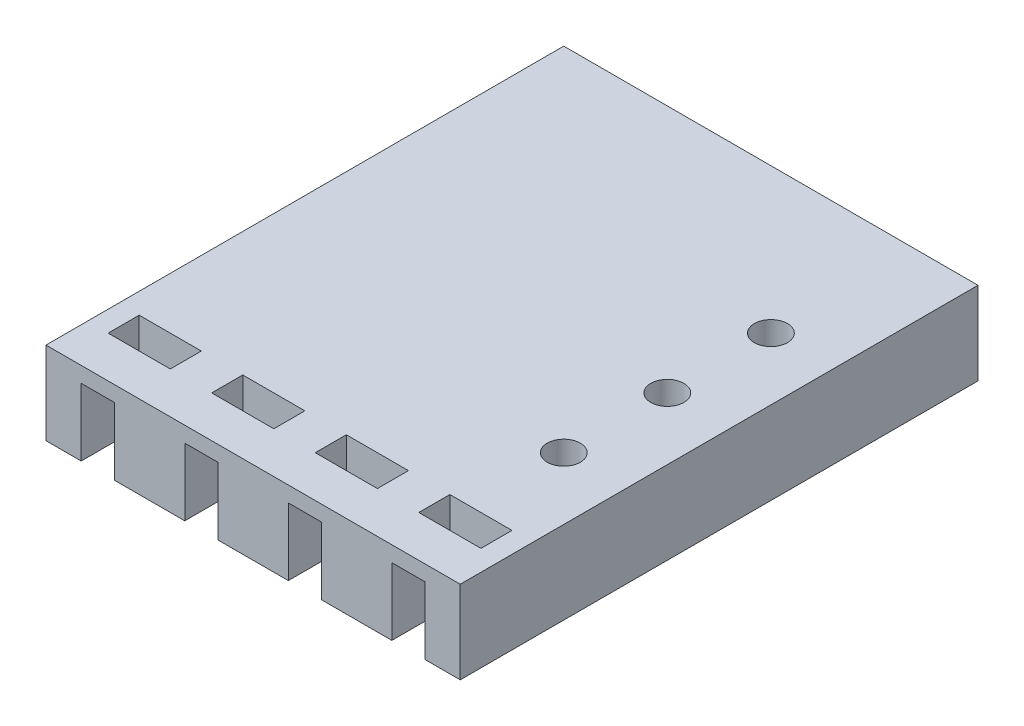
from build123d import *

# Parameters (mm, degrees)
SKETCH_1_W          = 40
SKETCH_1_H          = 50
EXTRUDE_1_DEPTH     = 8
SKETCH_2_W          = 3.2
SKETCH_2_H          = 4
CUT_EXTRUDE_1_DEPTH = 6.5
SKETCH_3_W          = 6
SKETCH_3_H          = 3
CUT_EXTRUDE_2_DEPTH = 16.5
SKETCH_10_R         = 1.6
CUT_EXTRUDE_7_DEPTH = 13
SKETCH_11_W         = 6
SKETCH_11_H         = 6
CUT_EXTRUDE_8_DEPTH = 3


with BuildPart() as part:
    # 草图1 → 凸台-拉伸1 (new body)
    with BuildSketch(Plane(origin=(0, 0, 0), x_dir=(1, 0, 0), z_dir=(0, 1, 0))):
        with Locations((20, 25)):
            Rectangle(SKETCH_1_W, SKETCH_1_H)
    extrude(amount=EXTRUDE_1_DEPTH)

    # 草图2 → 切除-拉伸1 (cut)
    with BuildSketch(Plane.XZ):
        with Locations((5, -2)):
            Rectangle(SKETCH_2_W, SKETCH_2_H)
        with Locations((15, -2)):
            Rectangle(SKETCH_2_W, SKETCH_2_H)
        with Locations((25, -2)):
            Rectangle(SKETCH_2_W, SKETCH_2_H)
        with Locations((35, -2)):
            Rectangle(SKETCH_2_W, SKETCH_2_H)
    extrude(amount=-CUT_EXTRUDE_1_DEPTH, mode=Mode.SUBTRACT)

    # 草图3 → 切除-拉伸2 (cut)
    with BuildSketch(Plane.XZ):
        with Locations((5, -5.5)):
            Rectangle(SKETCH_3_W, SKETCH_3_H)
        with Locations((15, -5.5)):
            Rectangle(SKETCH_3_W, SKETCH_3_H)
        with Locations((25, -5.5)):
            Rectangle(SKETCH_3_W, SKETCH_3_H)
        with Locations((35, -5.5)):
            Rectangle(SKETCH_3_W, SKETCH_3_H)
    extrude(amount=-CUT_EXTRUDE_2_DEPTH, mode=Mode.SUBTRACT)

    # 草图10 → 切除-拉伸7 (cut)
    with BuildSketch(Plane(origin=(0, 8, 0), x_dir=(1, 0, 0), z_dir=(0, 1, 0))):
        with Locations(Location((34, 16, 0), (0, 0, 270))):
            Circle(SKETCH_10_R)
        with Locations(Location((34, 26, 0), (0, 0, 270))):
            Circle(SKETCH_10_R)
        with Locations(Location((34, 36, 0), (0, 0, 270))):
            Circle(SKETCH_10_R)
    extrude(amount=-CUT_EXTRUDE_7_DEPTH, mode=Mode.SUBTRACT)

    # 草图11 → 切除-拉伸8 (cut)
    with BuildSketch(Plane.XZ):
        with Locations((34, -26)):
            Rectangle(SKETCH_11_W, SKETCH_11_H)
        with Locations((34, -36)):
            Rectangle(SKETCH_11_W, SKETCH_11_H)
        with Locations((34, -16)):
            Rectangle(SKETCH_11_W, SKETCH_11_H)
    extrude(amount=-CUT_EXTRUDE_8_DEPTH, mode=Mode.SUBTRACT)


solid = part.part
